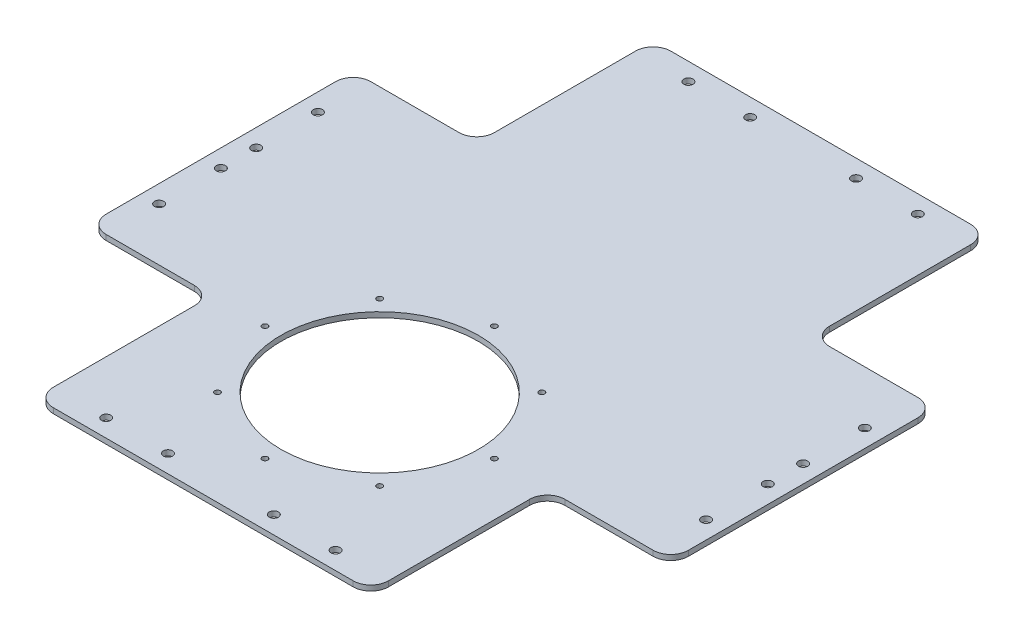
from build123d import *

# Parameters (mm, degrees)
SKETCH1_R           = 56
BOSS_EXTRUDE1_DEPTH = 3
FILLET1_R           = 10
SKETCH2_R           = 2.6
SKETCH2_R_2         = 1.6
CUT_EXTRUDE1_DEPTH  = 482.049893462


with BuildPart() as part:
    # Sketch1 → Boss-Extrude1 (new body)
    with BuildSketch(Plane(origin=(0, 0, 0), x_dir=(1, 0, 0), z_dir=(0, 1, 0))):
        Polygon((70, 100), (70, 0), (260, 0), (260, 100), (330, 100), (330, 250), (260, 250), (260, 350), (70, 350), (70, 250), (0, 250), (0, 100), align=None)
        with Locations(Location((165, 100, 0), (0, 0, 270))):
            Circle(SKETCH1_R, mode=Mode.SUBTRACT)
    extrude(amount=BOSS_EXTRUDE1_DEPTH)

    # Fillet1
    fillet1_edges = [part.edges().sort_by_distance(p)[0] for p in [
        (70, 1.5, 0),
        (70, 1.5, -100),
        (0, 1.5, -100),
        (0, 1.5, -250),
        (70, 1.5, -250),
        (70, 1.5, -350),
        (260, 1.5, -350),
        (260, 1.5, -250),
        (330, 1.5, -250),
        (330, 1.5, -100),
        (260, 1.5, -100),
        (260, 1.5, 0),
    ]]
    fillet(fillet1_edges, radius=FILLET1_R)

    # Sketch2 → Cut-Extrude1 (cut, through all)
    with BuildSketch(Plane(origin=(0, 3, 0), x_dir=(1, 0, 0), z_dir=(0, 1, 0))):
        with Locations(Location((100, 340, 0), (0, 0, 270))):
            Circle(SKETCH2_R)
        with Locations(Location((135, 340, 0), (0, 0, 270))):
            Circle(SKETCH2_R)
        with Locations(Location((195, 340, 0), (0, 0, 270))):
            Circle(SKETCH2_R)
        with Locations(Location((230, 340, 0), (0, 0, 270))):
            Circle(SKETCH2_R)
        with Locations(Location((10, 220, 0), (0, 0, 270))):
            Circle(SKETCH2_R)
        with Locations(Location((10, 185, 0), (0, 0, 270))):
            Circle(SKETCH2_R)
        with Locations(Location((10, 130, 0), (0, 0, 270))):
            Circle(SKETCH2_R)
        with Locations(Location((10, 165, 0), (0, 0, 270))):
            Circle(SKETCH2_R)
        with Locations(Location((100, 10, 0), (0, 0, 270))):
            Circle(SKETCH2_R)
        with Locations(Location((135, 10, 0), (0, 0, 270))):
            Circle(SKETCH2_R)
        with Locations(Location((195, 10, 0), (0, 0, 270))):
            Circle(SKETCH2_R)
        with Locations(Location((230, 10, 0), (0, 0, 270))):
            Circle(SKETCH2_R)
        with Locations(Location((320, 130, 0), (0, 0, 270))):
            Circle(SKETCH2_R)
        with Locations(Location((320, 165, 0), (0, 0, 270))):
            Circle(SKETCH2_R)
        with Locations(Location((320, 220, 0), (0, 0, 270))):
            Circle(SKETCH2_R)
        with Locations(Location((320, 185, 0), (0, 0, 270))):
            Circle(SKETCH2_R)
        with Locations(Location((165, 165, 0), (0, 0, 270))):
            Circle(SKETCH2_R_2)
        with Locations(Location((210.961940777, 145.961940777, 0), (0, 0, 270))):
            Circle(SKETCH2_R_2)
        with Locations(Location((230, 100, 0), (0, 0, 270))):
            Circle(SKETCH2_R_2)
        with Locations(Location((210.961940777, 54.038059223, 0), (0, 0, 270))):
            Circle(SKETCH2_R_2)
        with Locations(Location((165, 35, 0), (0, 0, 270))):
            Circle(SKETCH2_R_2)
        with Locations(Location((119.038059223, 54.038059223, 0), (0, 0, 270))):
            Circle(SKETCH2_R_2)
        with Locations(Location((100, 100, 0), (0, 0, 270))):
            Circle(SKETCH2_R_2)
        with Locations(Location((119.038059223, 145.961940777, 0), (0, 0, 270))):
            Circle(SKETCH2_R_2)
    extrude(amount=-CUT_EXTRUDE1_DEPTH, mode=Mode.SUBTRACT)


solid = part.part
